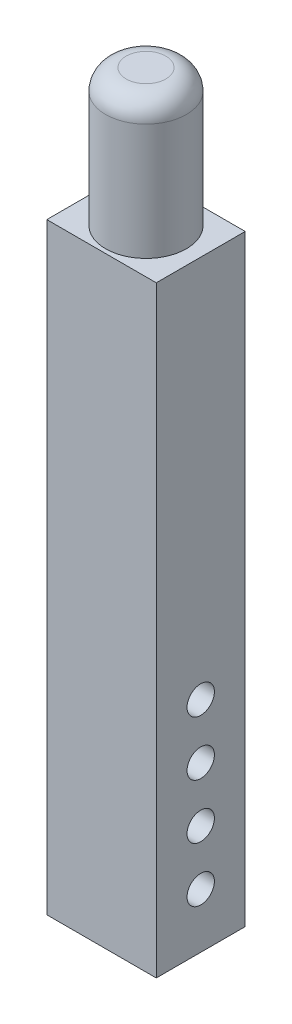
from build123d import *

# Parameters (mm, degrees)
SKETCH1_W           = 10.16
SKETCH1_H           = 8.255
BOSS_EXTRUDE1_DEPTH = 55.88
SKETCH2_R           = 3.7465
BOSS_EXTRUDE2_DEPTH = 12.7
SKETCH3_R           = 1.27
CUT_EXTRUDE2_DEPTH  = 70.451265332
LPATTERN1_COUNT     = 4
LPATTERN1_PITCH     = 5.08
FILLET1_R           = 1.905


with BuildPart() as part:
    # Sketch1 → Boss-Extrude1 (new body)
    with BuildSketch(Plane(origin=(0, 0, 0), x_dir=(1, 0, 0), z_dir=(0, 1, 0))):
        Rectangle(SKETCH1_W, SKETCH1_H)
    extrude(amount=BOSS_EXTRUDE1_DEPTH)

    # Sketch2 → Boss-Extrude2 (add)
    with BuildSketch(Plane(origin=(0, 55.88, 0), x_dir=(1, 0, 0), z_dir=(0, 1, 0))):
        with Locations(Location((0, 0, 0), (0, 0, 270))):
            Circle(SKETCH2_R)
    extrude(amount=BOSS_EXTRUDE2_DEPTH)

    # Sketch3 → Cut-Extrude2 (cut, through all)
    with BuildSketch(Plane(origin=(5.08, 0, 0), x_dir=(0, 0, -1), z_dir=(1, 0, 0))):
        with Locations((0, 5.08)):
            Circle(SKETCH3_R)
    cut_extrude2 = extrude(amount=-CUT_EXTRUDE2_DEPTH, mode=Mode.SUBTRACT)

    # LPattern1: Cut-Extrude2 ×4
    with Locations(*[(0, i * LPATTERN1_PITCH, 0) for i in range(1, LPATTERN1_COUNT)]):
        add(cut_extrude2, mode=Mode.SUBTRACT)

    # Fillet1
    fillet1_edges = [part.edges().sort_by_distance(p)[0] for p in [
        (0, 68.58, -3.7465),
    ]]
    fillet(fillet1_edges, radius=FILLET1_R)


solid = part.part
